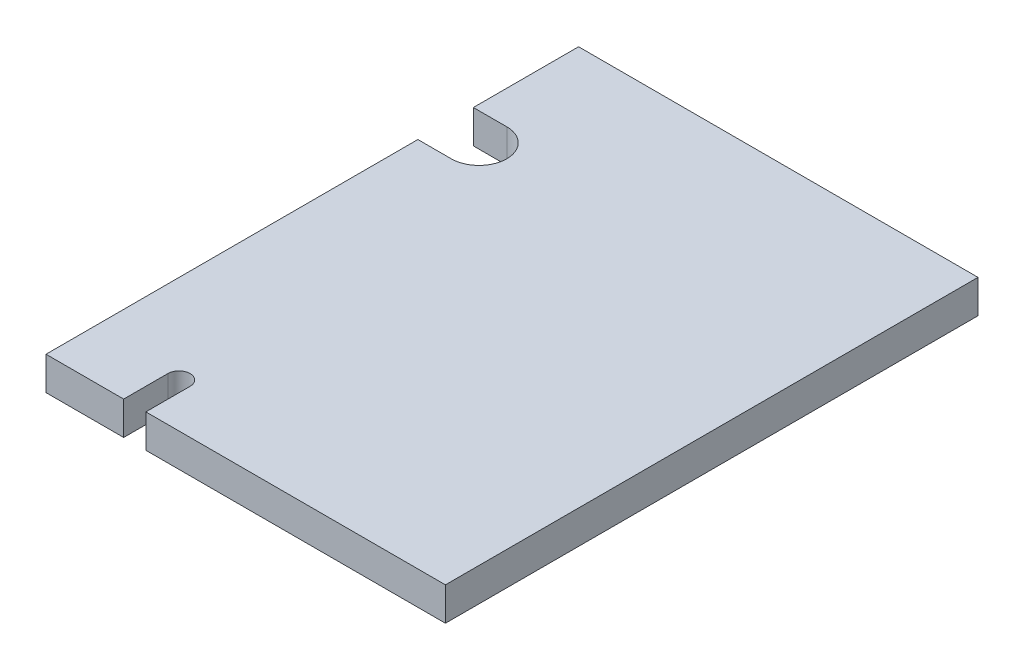
from build123d import *

# Parameters (mm, degrees)
SKETCH1_W           = 228.6
SKETCH1_H           = 304.8
BOSS_EXTRUDE2_DEPTH = 19.05
CUT_EXTRUDE1_DEPTH  = 19.05


with BuildPart() as part:
    # Sketch1 → Boss-Extrude2 (new body)
    with BuildSketch(Plane(origin=(0, 0, 0), x_dir=(1, 0, 0), z_dir=(0, 1, 0))):
        with Locations((114.3, 152.4)):
            Rectangle(SKETCH1_W, SKETCH1_H)
    extrude(amount=BOSS_EXTRUDE2_DEPTH)

    # Sketch3 → Cut-Extrude1 (cut)
    with BuildSketch(Plane.XZ):
        with BuildLine():
            Line((19.125478143, -212.832325894), (0, -212.832325894))
            Line((0, -212.832325894), (0, -244.582325894))
            Line((0, -244.582325894), (19.125478143, -244.582325894))
            ThreePointArc((19.125478143, -244.582325894), (30.350798294, -239.932646046), (35.000478143, -228.707325894))
            ThreePointArc((35.000478143, -228.707325894), (30.350798294, -217.482005743), (19.125478143, -212.832325894))
        make_face()
        with BuildLine():
            Line((44.449497967, -25.319930082), (44.449497967, 0))
            Line((44.449497967, 0), (57.149497967, 0))
            Line((57.149497967, 0), (57.149497967, -25.319930082))
            ThreePointArc((57.149497967, -25.319930082), (55.289626028, -29.810058143), (50.799497967, -31.669930082))
            ThreePointArc((50.799497967, -31.669930082), (46.309369907, -29.810058143), (44.449497967, -25.319930082))
        make_face()
    extrude(amount=-CUT_EXTRUDE1_DEPTH, mode=Mode.SUBTRACT)


solid = part.part
